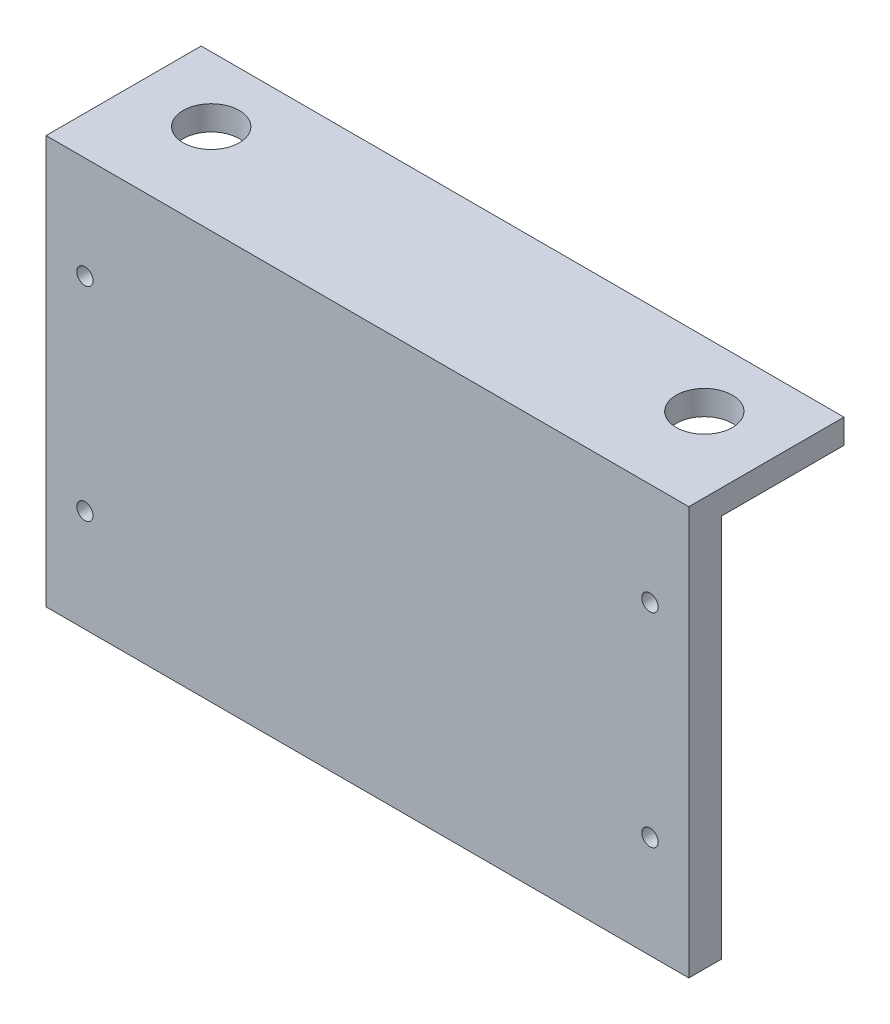
from build123d import *

# Parameters (mm, degrees)
SKETCH1_W           = 100
SKETCH1_H           = 63.5
BOSS_EXTRUDE1_DEPTH = 5.08
SKETCH3_W           = 100
SKETCH3_H           = 3.81
BOSS_EXTRUDE2_DEPTH = 19.05
SKETCH8_R           = 4.364936917
CUT_EXTRUDE2_DEPTH  = 84.037054981
SKETCH11_R          = 1.27
CUT_EXTRUDE5_DEPTH  = 64.955604915


with BuildPart() as part:
    # Sketch1 → Boss-Extrude1 (new body)
    with BuildSketch(Plane.XY):
        Rectangle(SKETCH1_W, SKETCH1_H)
    extrude(amount=BOSS_EXTRUDE1_DEPTH)

    # Sketch3 → Boss-Extrude2 (add)
    with BuildSketch(Plane(origin=(0, 0, 0), x_dir=(-1, 0, 0), z_dir=(0, 0, -1))):
        with Locations((0, 29.845)):
            Rectangle(SKETCH3_W, SKETCH3_H)
    extrude(amount=BOSS_EXTRUDE2_DEPTH)

    # Sketch8 → Cut-Extrude2 (cut, through all)
    with BuildSketch(Plane(origin=(0, 31.75, 0), x_dir=(1, 0, 0), z_dir=(0, 1, 0))):
        with Locations(Location((-38.35758865, 8.973092831, 0), (0, 0, 270))):
            Circle(SKETCH8_R)
        with Locations(Location((38.35758865, 8.973092831, 0), (0, 0, 270))):
            Circle(SKETCH8_R)
    extrude(amount=-CUT_EXTRUDE2_DEPTH, mode=Mode.SUBTRACT)

    # Sketch11 → Cut-Extrude5 (cut, through all)
    with BuildSketch(Plane.XY.offset(5.08)):
        with Locations((-43.9547, 15.82674)):
            Circle(SKETCH11_R)
        with Locations((-43.9547, -15.82674)):
            Circle(SKETCH11_R)
        with Locations((43.9547, -15.82674)):
            Circle(SKETCH11_R)
        with Locations((43.9547, 15.82674)):
            Circle(SKETCH11_R)
    extrude(amount=-CUT_EXTRUDE5_DEPTH, mode=Mode.SUBTRACT)


solid = part.part
